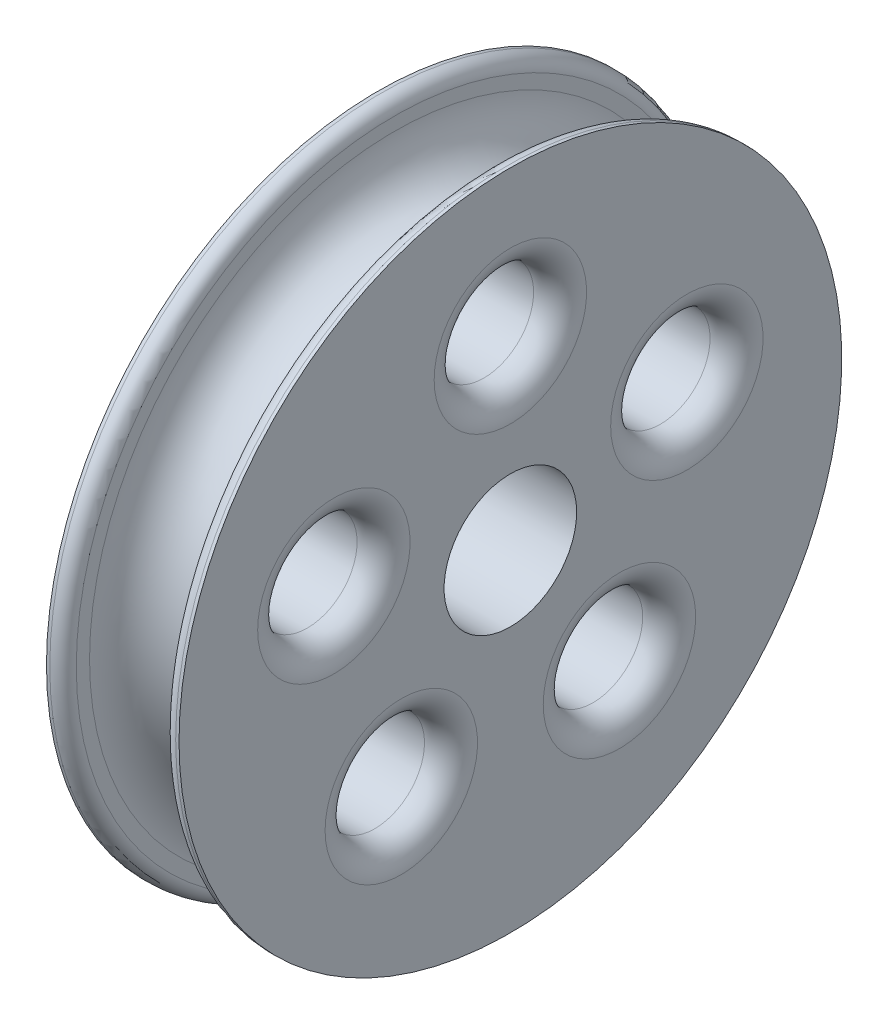
from build123d import *

# Parameters (mm, degrees)
SKETCH3_R          = 9.525
CUT_EXTRUDE2_DEPTH = 94.3255592
FILLET3_R          = 5.08
FILLET4_R          = 2.54
SKETCH4_R          = 12.7
CUT_EXTRUDE3_DEPTH = 94.325559268


with BuildPart() as part:
    # Sketch2 → Revolve3 (revolve)
    with BuildSketch(Plane.XY, mode=Mode.PRIVATE) as revolve3_sk:
        with BuildLine():
            Line((-12.7, 0), (12.7, 0))
            Line((12.7, 0), (12.7, 63.5))
            Line((12.7, 63.5), (9.525, 63.5))
            Line((9.525, 63.5), (9.525, 58.42))
            ThreePointArc((9.525, 58.42), (0, 48.895), (-9.525, 58.42))
            Line((-9.525, 58.42), (-9.525, 63.5))
            Line((-9.525, 63.5), (-12.7, 63.5))
            Line((-12.7, 63.5), (-12.7, 0))
        make_face()
    revolve(revolve3_sk.sketch.rotate(Axis((-12.7, 0, 0), (1, 0, 0)), 90), axis=Axis((-12.7, 0, 0), (1, 0, 0)))

    # Sketch3 → Cut-Extrude2 (cut, through all)
    with BuildSketch(Plane(origin=(12.7, 0, 0), x_dir=(0, 0, -1), z_dir=(1, 0, 0))):
        with Locations((0, 35.56)):
            Circle(SKETCH3_R)
        with Locations((33.819569719, 10.98864432)):
            Circle(SKETCH3_R)
        with Locations((20.901643572, -28.76864432)):
            Circle(SKETCH3_R)
        with Locations((-20.901643572, -28.76864432)):
            Circle(SKETCH3_R)
        with Locations((-33.819569719, 10.98864432)):
            Circle(SKETCH3_R)
    extrude(amount=-CUT_EXTRUDE2_DEPTH, mode=Mode.SUBTRACT)

    # Fillet3
    fillet3_edges = [part.edges().sort_by_distance(p)[0] for p in [
        (-12.7, 35.56, 9.525),
        (12.7, 35.56, 9.525),
        (-12.7, 10.98864432, -24.294569719),
        (12.7, 10.98864432, -24.294569719),
        (-12.7, -28.76864432, -11.376643572),
        (12.7, -28.76864432, -11.376643572),
        (-12.7, -28.76864432, 30.426643572),
        (12.7, -28.76864432, 30.426643572),
        (-12.7, 10.98864432, 43.344569719),
        (12.7, 10.98864432, 43.344569719),
    ]]
    fillet(fillet3_edges, radius=FILLET3_R)

    # Fillet4
    fillet4_edges = [part.edges().sort_by_distance(p)[0] for p in [
        (-9.525, 0, -63.5),
        (9.525, 0, -63.5),
    ]]
    fillet(fillet4_edges, radius=FILLET4_R)

    # Sketch4 → Cut-Extrude3 (cut, through all)
    with BuildSketch(Plane(origin=(12.7, 0, 0), x_dir=(0, 0, -1), z_dir=(1, 0, 0))):
        Circle(SKETCH4_R)
    extrude(amount=-CUT_EXTRUDE3_DEPTH, mode=Mode.SUBTRACT)


solid = part.part
